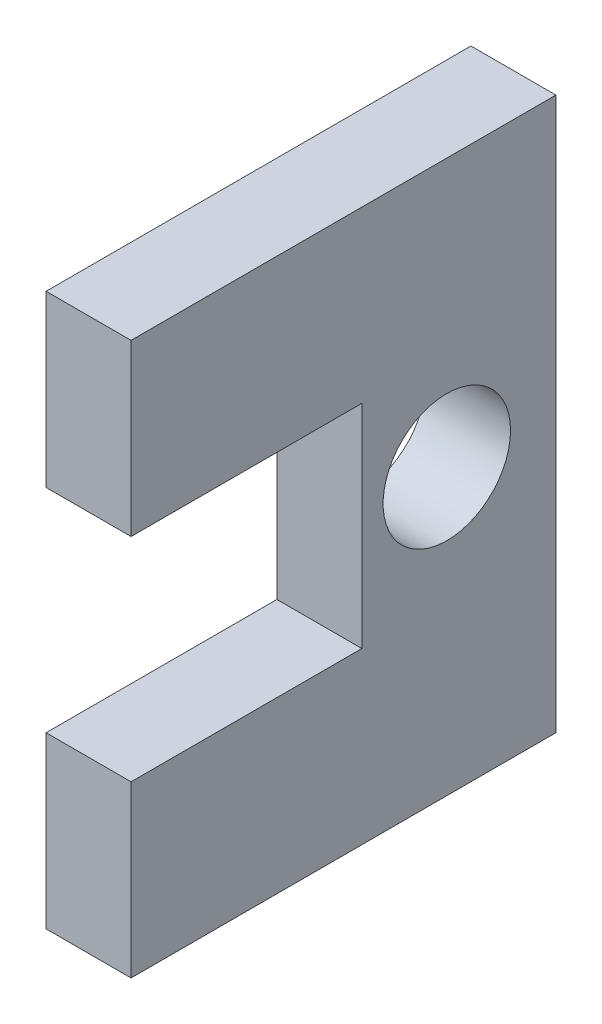
from build123d import *

# Parameters (mm, degrees)
SKETCH1_R           = 1.5
BOSS_EXTRUDE1_DEPTH = 2


with BuildPart() as part:
    # Sketch1 → Boss-Extrude1 (new body)
    with BuildSketch(Plane(origin=(0, 0, 0), x_dir=(0, 0, -1), z_dir=(1, 0, 0))):
        Polygon((0.432432432, -6.97149937), (-5, -6.97149937), (-5, -10.97149937), (5, -10.97149937), (5, 2.027027027), (-5, 2.027027027), (-5, -1.972972973), (0.432432432, -1.972972973), align=None)
        with Locations((2.432432432, -4.272972973)):
            Circle(SKETCH1_R, mode=Mode.SUBTRACT)
    extrude(amount=BOSS_EXTRUDE1_DEPTH)


solid = part.part
